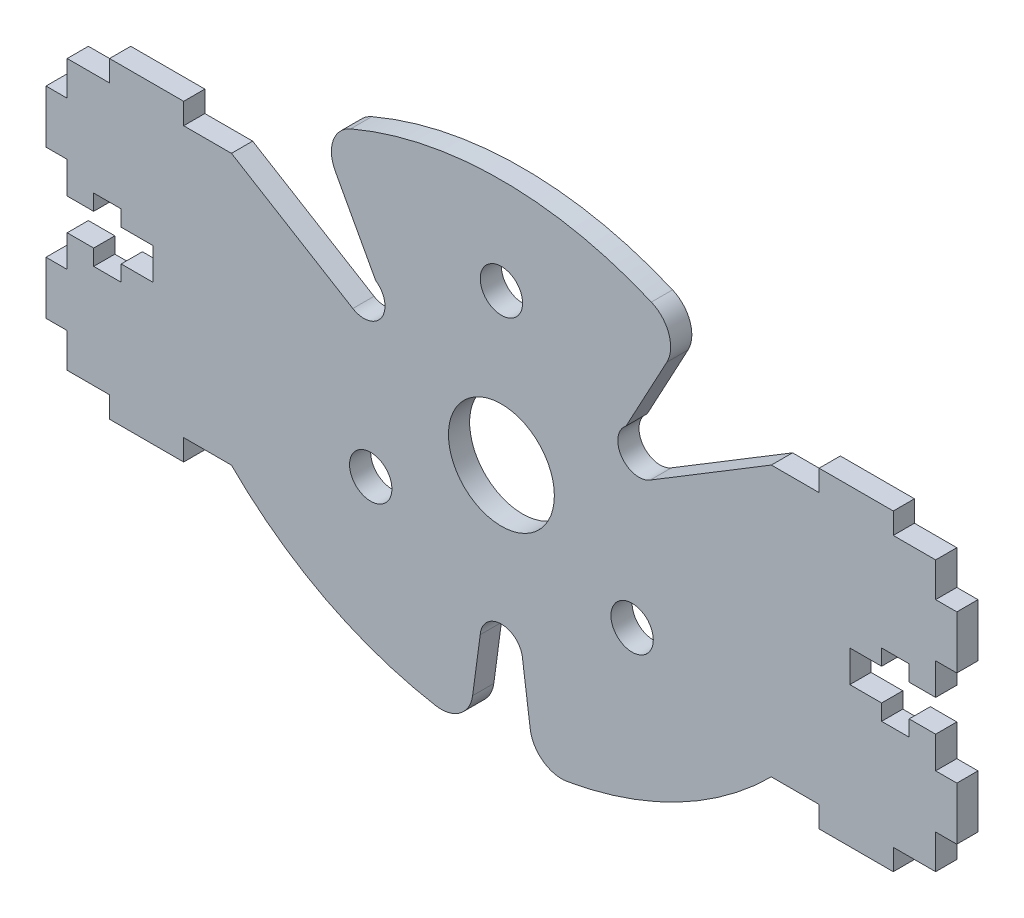
from build123d import *

# Parameters (mm, degrees)
SKETCH_1_R      = 2
SKETCH_1_R_2    = 5
EXTRUDE_2_DEPTH = 2


with BuildPart() as part:
    # 草图1 → 凸台-拉伸2 (new body)
    with BuildSketch(Plane.XY):
        with BuildLine():
            Line((-37, -12.75), (-41, -12.75))
            Line((-41, -12.75), (-41, -9.5))
            Line((-41, -9.5), (-43, -9.5))
            Line((-43, -9.5), (-43, -4.5))
            Line((-43, -4.5), (-41, -4.5))
            Line((-41, -4.5), (-41, -1.5))
            Line((-41, -1.5), (-38.5, -1.5))
            Line((-38.5, -1.5), (-38.5, -3))
            Line((-38.5, -3), (-35.9, -3))
            Line((-35.9, -3), (-35.9, -1.5))
            Line((-35.9, -1.5), (-32.9, -1.5))
            Line((-32.9, -1.5), (-32.9, 1.5))
            Line((-32.9, 1.5), (-35.9, 1.5))
            Line((-35.9, 1.5), (-35.9, 3))
            Line((-35.9, 3), (-38.5, 3))
            Line((-38.5, 3), (-38.5, 1.5))
            Line((-38.5, 1.5), (-41, 1.5))
            Line((-41, 1.5), (-41, 4.5))
            Line((-41, 4.5), (-43, 4.5))
            Line((-43, 4.5), (-43, 9.5))
            Line((-43, 9.5), (-41, 9.5))
            Line((-41, 9.5), (-41, 12.75))
            Line((-41, 12.75), (-37, 12.75))
            Line((-37, 12.75), (-37, 14.75))
            Line((-37, 14.75), (-30, 14.75))
            Line((-30, 14.75), (-30, 12.75))
            Line((-30, 12.75), (-25.488968202, 12.75))
            Line((-25.488968202, 12.75), (-14.028482804, 5.790513304))
            ThreePointArc((-14.028482804, 5.790513304), (-11.304453577, 6.424059234), (-11.8771357, 9.161530853))
            Line((-11.8771357, 9.161530853), (-15.689334886, 16.190924706))
            ThreePointArc((-15.689334886, 16.190924706), (-15.886477166, 18.604361531), (-14.237063941, 20.37720625))
            ThreePointArc((-14.237063941, 20.37720625), (-0.042376251, 23.307851412), (14.159162664, 20.410588547))
            ThreePointArc((14.159162664, 20.410588547), (15.812739599, 18.641626787), (15.621272277, 16.227733118))
            Line((15.621272277, 16.227733118), (11.768369699, 9.083252425))
            ThreePointArc((11.768369699, 9.083252425), (11.351042044, 6.354326573), (14.057146467, 5.808251922))
            Line((14.057146467, 5.808251922), (25.488968202, 12.75))
            Line((25.488968202, 12.75), (30, 12.75))
            Line((30, 12.75), (30, 14.75))
            Line((30, 14.75), (37, 14.75))
            Line((37, 14.75), (37, 12.75))
            Line((37, 12.75), (41, 12.75))
            Line((41, 12.75), (41, 9.5))
            Line((41, 9.5), (43, 9.5))
            Line((43, 9.5), (43, 4.5))
            Line((43, 4.5), (41, 4.5))
            Line((41, 4.5), (41, 1.5))
            Line((41, 1.5), (38.5, 1.5))
            Line((38.5, 1.5), (38.5, 3))
            Line((38.5, 3), (35.9, 3))
            Line((35.9, 3), (35.9, 1.5))
            Line((35.9, 1.5), (32.9, 1.5))
            Line((32.9, 1.5), (32.9, -1.5))
            Line((32.9, -1.5), (35.9, -1.5))
            Line((35.9, -1.5), (35.9, -3))
            Line((35.9, -3), (38.5, -3))
            Line((38.5, -3), (38.5, -1.5))
            Line((38.5, -1.5), (41, -1.5))
            Line((41, -1.5), (41, -4.5))
            Line((41, -4.5), (43, -4.5))
            Line((43, -4.5), (43, -9.5))
            Line((43, -9.5), (41, -9.5))
            Line((41, -9.5), (41, -12.75))
            Line((41, -12.75), (37, -12.75))
            Line((37, -12.75), (37, -14.75))
            Line((37, -14.75), (30, -14.75))
            Line((30, -14.75), (30, -12.75))
            Line((30, -12.75), (25.488968202, -12.75))
            ThreePointArc((25.488968202, -12.75), (16.622058042, -19.246687746), (6.209460579, -22.769025255))
            ThreePointArc((6.209460579, -22.769025255), (3.920471276, -22.23446682), (2.719464237, -20.213871155))
            Line((2.719464237, -20.213871155), (2, -14.866068747))
            ThreePointArc((2, -14.866068747), (0, -12.997534789), (-2, -14.866068747))
            Line((-2, -14.866068747), (-2.719464237, -20.213871155))
            ThreePointArc((-2.719464237, -20.213871155), (-3.920471276, -22.23446682), (-6.209460579, -22.769025255))
            ThreePointArc((-6.209460579, -22.769025255), (-16.622058042, -19.246687746), (-25.488968202, -12.75))
            Line((-25.488968202, -12.75), (-30, -12.75))
            Line((-30, -12.75), (-30, -14.75))
            Line((-30, -14.75), (-37, -14.75))
            Line((-37, -14.75), (-37, -12.75))
        make_face()
        with Locations((0, 14.25)):
            Circle(SKETCH_1_R, mode=Mode.SUBTRACT)
        with Locations((12.340862004, -7.125)):
            Circle(SKETCH_1_R, mode=Mode.SUBTRACT)
        with Locations((-12.340862004, -7.125)):
            Circle(SKETCH_1_R, mode=Mode.SUBTRACT)
        Circle(SKETCH_1_R_2, mode=Mode.SUBTRACT)
    extrude(amount=EXTRUDE_2_DEPTH)


solid = part.part
